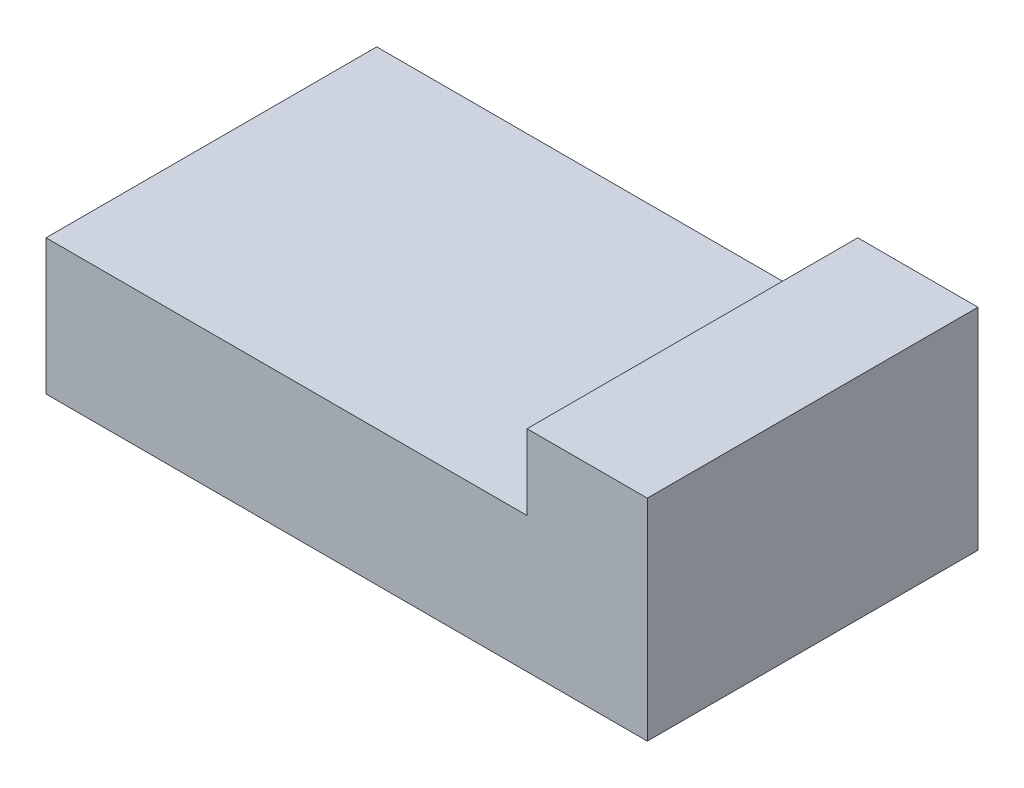
from build123d import *

# Parameters (mm, degrees)
SKETCH_1_W      = 40
SKETCH_1_H      = 22
EXTRUDE_1_DEPTH = 9
SKETCH_2_W      = 8
SKETCH_2_H      = 22
EXTRUDE_2_DEPTH = 5


with BuildPart() as part:
    # Эскиз1 → Бобышка-Вытянуть1 (new body)
    with BuildSketch(Plane(origin=(0, 0, 0), x_dir=(1, 0, 0), z_dir=(0, 1, 0))):
        Rectangle(SKETCH_1_W, SKETCH_1_H)
    extrude(amount=EXTRUDE_1_DEPTH)

    # Эскиз2 → Бобышка-Вытянуть2 (add)
    with BuildSketch(Plane(origin=(0, 9, 0), x_dir=(1, 0, 0), z_dir=(0, 1, 0))):
        with Locations((16, 0)):
            Rectangle(SKETCH_2_W, SKETCH_2_H)
    extrude(amount=EXTRUDE_2_DEPTH)


solid = part.part
